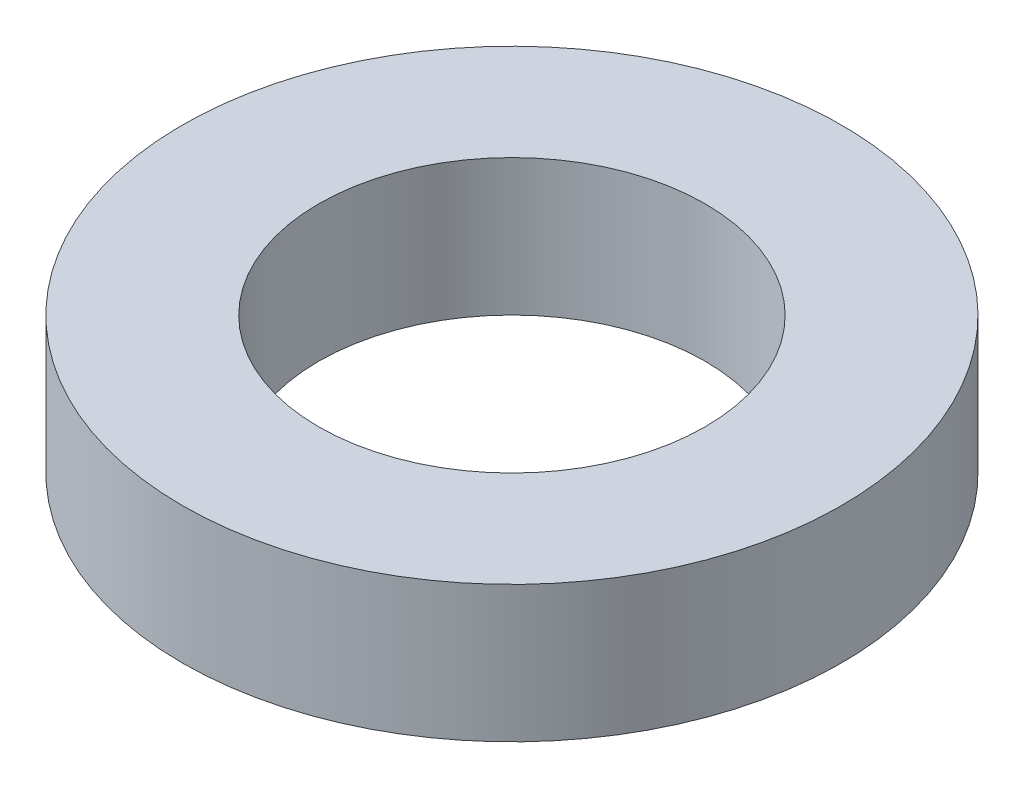
from build123d import *

# Parameters (mm, degrees)
SKETCH1_R           = 7.25
SKETCH1_R_2         = 4.25
BOSS_EXTRUDE1_DEPTH = 3


with BuildPart() as part:
    # Sketch1 → Boss-Extrude1 (new body)
    with BuildSketch(Plane(origin=(0, 0, 0), x_dir=(1, 0, 0), z_dir=(0, 1, 0))):
        with Locations(Location((0, 0, 0), (0, 0, 270))):
            Circle(SKETCH1_R)
        with Locations(Location((0, 0, 0), (0, 0, 270))):
            Circle(SKETCH1_R_2, mode=Mode.SUBTRACT)
    extrude(amount=BOSS_EXTRUDE1_DEPTH)


solid = part.part
